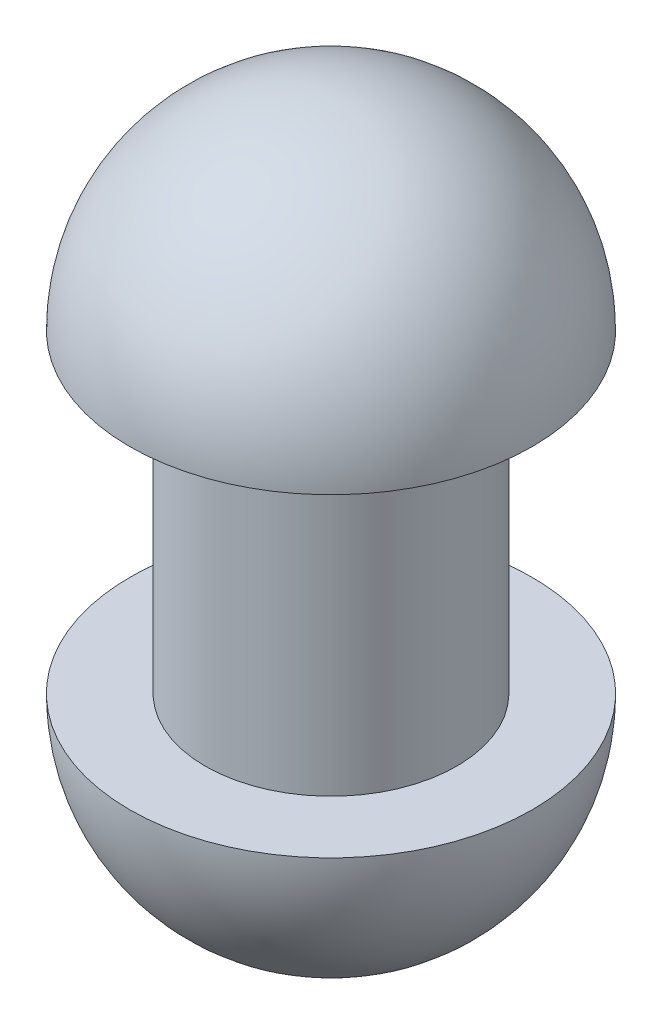
from build123d import *


with BuildPart() as part:
    # Sketch1 → Revolve1 (revolve)
    with BuildSketch(Plane.XY):
        with BuildLine():
            Line((9, -6.191094675), (9, -28.691094675))
            Line((9, -28.691094675), (14.4, -28.691094675))
            ThreePointArc((14.4, -28.691094675), (10.182337649, -38.873432324), (0, -43.091094675))
            Line((0, -43.091094675), (0, 8.208905325))
            ThreePointArc((0, 8.208905325), (10.182337649, 3.991242975), (14.4, -6.191094675))
            Line((14.4, -6.191094675), (9, -6.191094675))
        make_face()
    revolve(axis=Axis((0, 0, 0), (0, -1, 0)))


solid = part.part
